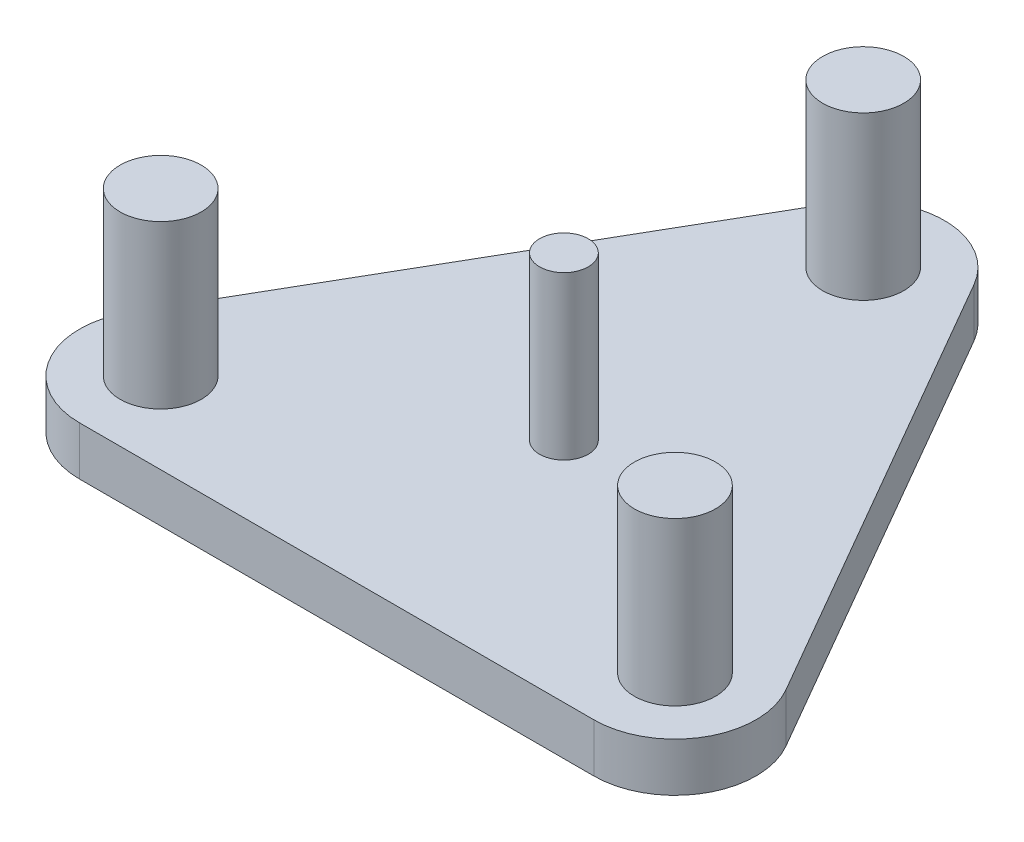
from build123d import *

# Parameters (mm, degrees)
SALIENTE_EXTRUIR1_DEPTH = 3
CROQUIS2_R              = 2.5
SALIENTE_EXTRUIR2_DEPTH = 10
CROQUIS3_R              = 1.5
SALIENTE_EXTRUIR3_DEPTH = 10


with BuildPart() as part:
    # Croquis1 → Saliente-Extruir1 (new body)
    with BuildSketch(Plane(origin=(0, 0, 0), x_dir=(1, 0, 0), z_dir=(0, 1, 0))):
        with BuildLine():
            Line((-15.839745962, 0), (15.839745962, 0))
            ThreePointArc((15.839745962, 0), (20.169872981, 2.5), (20.169872981, 7.5))
            Line((20.169872981, 7.5), (4.330127019, 34.935244785))
            ThreePointArc((4.330127019, 34.935244785), (0, 37.435244785), (-4.330127019, 34.935244785))
            Line((-4.330127019, 34.935244785), (-20.169872981, 7.5))
            ThreePointArc((-20.169872981, 7.5), (-20.169872981, 2.5), (-15.839745962, 0))
        make_face()
    extrude(amount=SALIENTE_EXTRUIR1_DEPTH)

    # Croquis2 → Saliente-Extruir2 (add)
    with BuildSketch(Plane(origin=(0, 3, 0), x_dir=(1, 0, 0), z_dir=(0, 1, 0))):
        with Locations(Location((0, 32.435244785, 0), (0, 0, 270))):
            Circle(CROQUIS2_R)
        with Locations(Location((15.839745962, 5, 0), (0, 0, 270))):
            Circle(CROQUIS2_R)
        with Locations(Location((-15.839745962, 5, 0), (0, 0, 270))):
            Circle(CROQUIS2_R)
    extrude(amount=SALIENTE_EXTRUIR2_DEPTH)

    # Croquis3 → Saliente-Extruir3 (add)
    with BuildSketch(Plane(origin=(0, 3, 0), x_dir=(1, 0, 0), z_dir=(0, 1, 0))):
        with Locations(Location((0.008103959, 13.990369441, 0), (0, 0, 270))):
            Circle(CROQUIS3_R)
    extrude(amount=SALIENTE_EXTRUIR3_DEPTH)


solid = part.part
